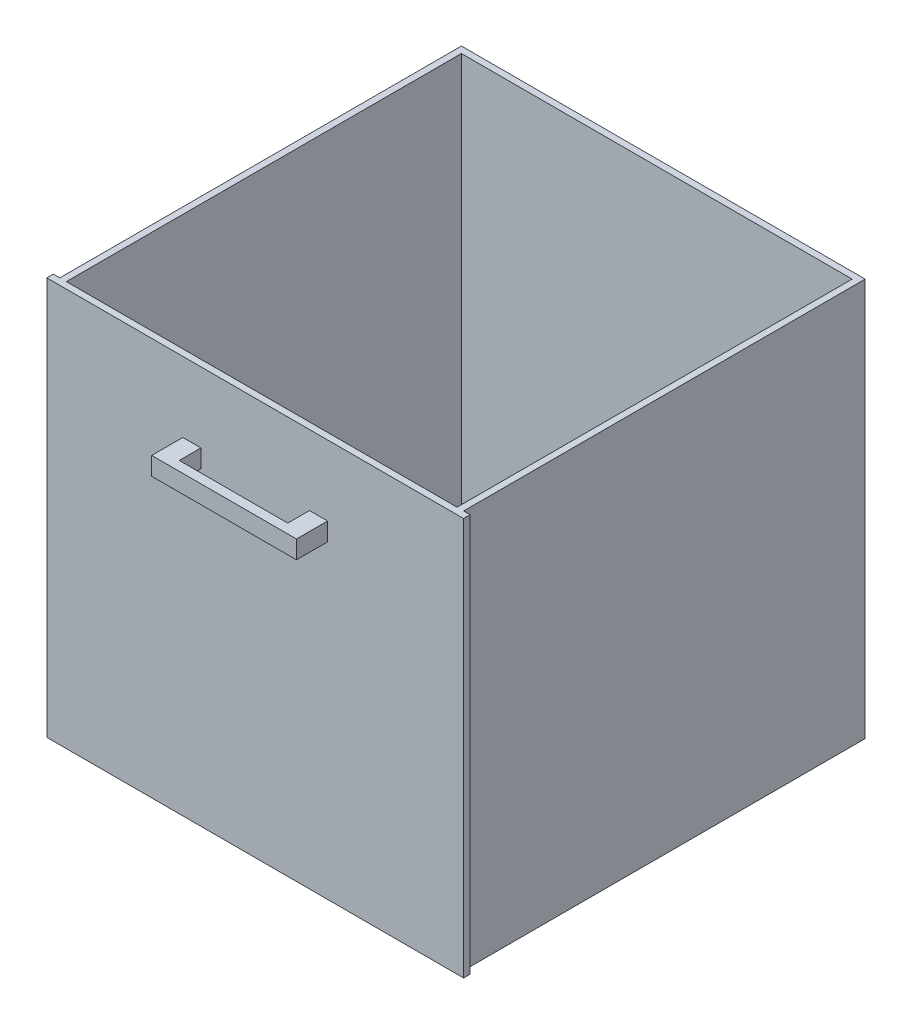
from build123d import *

# Parameters (mm, degrees)
BOSS_EXTRUDE1_DEPTH = 550
SKETCH3_W           = 540
SKETCH3_H           = 546
CUT_EXTRUDE1_DEPTH  = 545
SKETCH4_W           = 200
SKETCH4_H           = 25
BOSS_EXTRUDE2_DEPTH = 43
SKETCH6_W           = 150
SKETCH6_H           = 30
CUT_EXTRUDE2_DEPTH  = 25


with BuildPart() as part:
    # Sketch1 → Boss-Extrude1 (new body)
    with BuildSketch(Plane(origin=(0, 0, 0), x_dir=(1, 0, 0), z_dir=(0, 1, 0))):
        Polygon((-382.12099403, -271.280172414), (-373.12099403, -271.280172414), (-373.12099403, 283.719827586), (184.87900597, 283.719827586), (184.87900597, -271.280172414), (193.87900597, -271.280172414), (193.87900597, -280.280172414), (-382.12099403, -280.280172414), align=None)
    extrude(amount=BOSS_EXTRUDE1_DEPTH)

    # Sketch3 → Cut-Extrude1 (cut)
    with BuildSketch(Plane(origin=(0, 550, 0), x_dir=(1, 0, 0), z_dir=(0, 1, 0))):
        with Locations((-94.12099403, 1.719827586)):
            Rectangle(SKETCH3_W, SKETCH3_H)
    extrude(amount=-CUT_EXTRUDE1_DEPTH, mode=Mode.SUBTRACT)

    # Sketch4 → Boss-Extrude2 (add)
    with BuildSketch(Plane.XY.offset(280.280172414)):
        with Locations((-94.12099403, 440.468229794)):
            Rectangle(SKETCH4_W, SKETCH4_H)
    extrude(amount=BOSS_EXTRUDE2_DEPTH)

    # Sketch6 → Cut-Extrude2 (cut)
    with BuildSketch(Plane(origin=(0, 452.968229794, 0), x_dir=(1, 0, 0), z_dir=(0, 1, 0))):
        with Locations((-94.12099403, -295.280172414)):
            Rectangle(SKETCH6_W, SKETCH6_H)
    extrude(amount=-CUT_EXTRUDE2_DEPTH, mode=Mode.SUBTRACT)


solid = part.part
